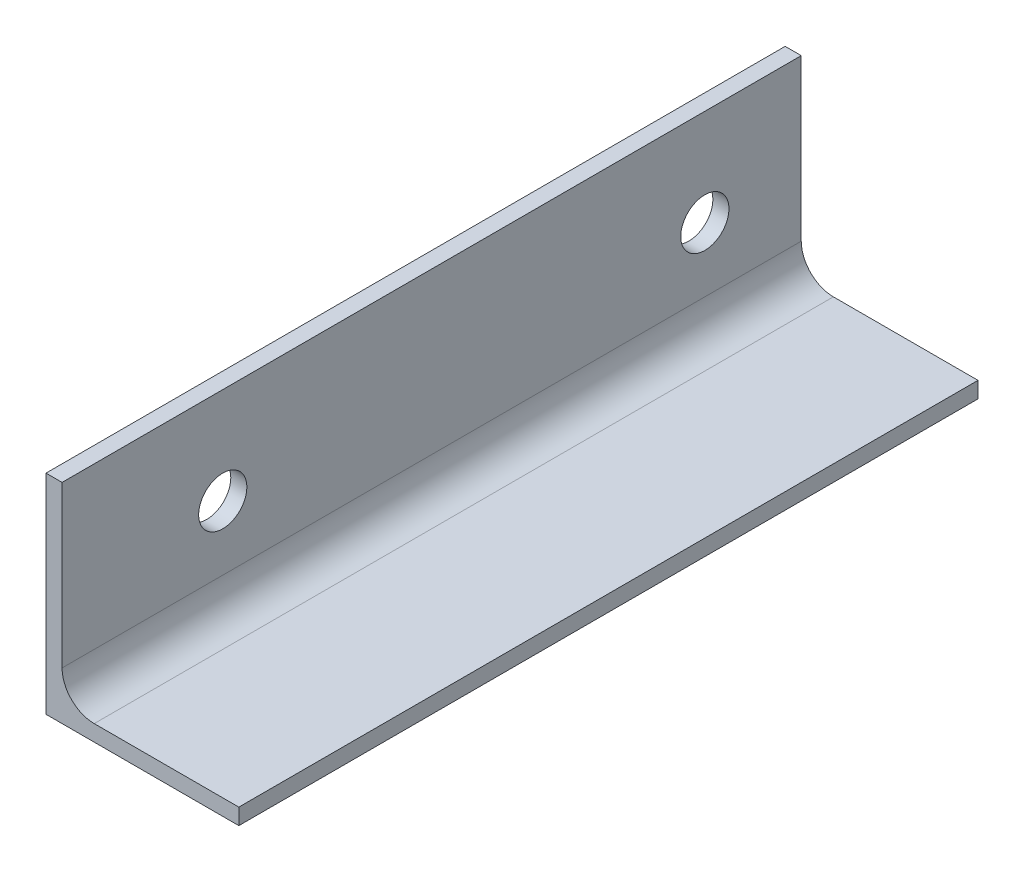
from build123d import *

# Parameters (mm, degrees)
BOSS_EXTRUDE1_DEPTH = 230
CUT_EXTRUDE1_REACH  = 241.061
SKETCH2_R           = 7.5


with BuildPart() as part:
    # Sketch1 → Boss-Extrude1 (new body)
    with BuildSketch(Plane.XY):
        with BuildLine():
            Line((2.5, -20), (2.5, 30))
            Line((2.5, 30), (-2.5, 30))
            Line((-2.5, 30), (-2.5, -30))
            Line((-2.5, -30), (-2.5, -35))
            Line((-2.5, -35), (57.5, -35))
            Line((57.5, -35), (57.5, -30))
            Line((57.5, -30), (12.5, -30))
            ThreePointArc((12.5, -30), (5.428932188, -27.071067812), (2.5, -20))
        make_face()
    extrude(amount=BOSS_EXTRUDE1_DEPTH)

    # Sketch2 → Cut-Extrude1 (cut, up to next)
    with BuildSketch(Plane(origin=(2.5, 0, 0), x_dir=(0, 0, -1), z_dir=(1, 0, 0)), mode=Mode.PRIVATE) as cut_extrude1_sk1:
        with Locations((-30, 0)):
            Circle(SKETCH2_R)
    cut_extrude1_tool1 = extrude(cut_extrude1_sk1.sketch, amount=-CUT_EXTRUDE1_REACH, mode=Mode.PRIVATE) & part.part
    # Sketch2 → Cut-Extrude1 (cut, up to next)
    with BuildSketch(Plane(origin=(2.5, 0, 0), x_dir=(0, 0, -1), z_dir=(1, 0, 0)), mode=Mode.PRIVATE) as cut_extrude1_sk2:
        with Locations((-180, 0)):
            Circle(SKETCH2_R)
    cut_extrude1_tool2 = extrude(cut_extrude1_sk2.sketch, amount=-CUT_EXTRUDE1_REACH, mode=Mode.PRIVATE) & part.part
    add(cut_extrude1_tool1.solids().sort_by_distance((2.5, 0, 30))[0], mode=Mode.SUBTRACT)
    add(cut_extrude1_tool2.solids().sort_by_distance((2.5, 0, 180))[0], mode=Mode.SUBTRACT)


solid = part.part
